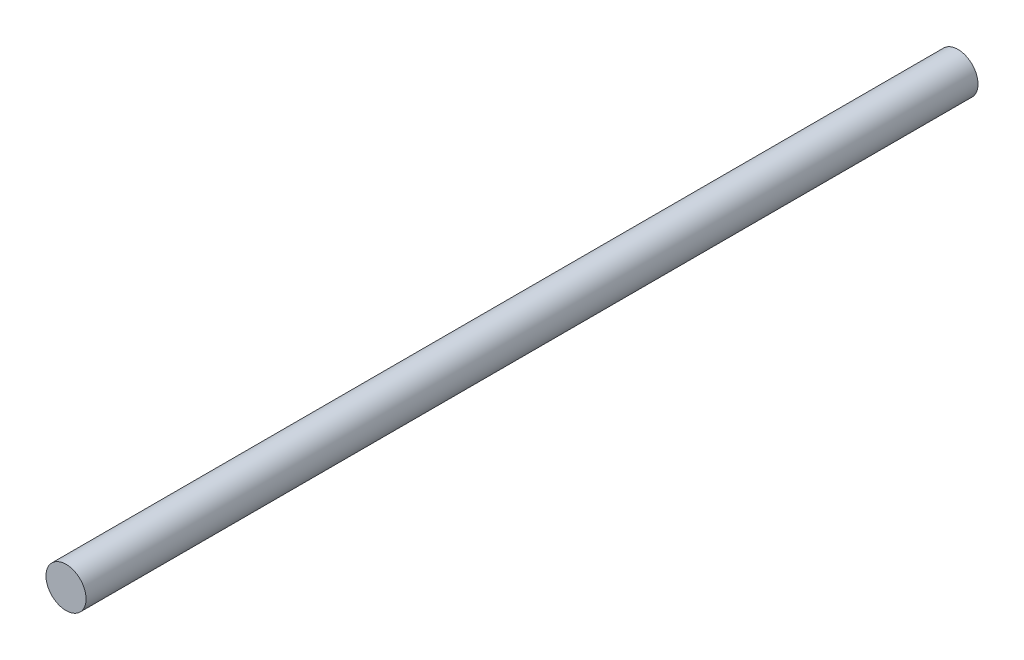
from build123d import *

# Parameters (mm, degrees)
SCHIZZO1_R                   = 9
ESTRUSIONE_ESTRUSIONE1_DEPTH = 400


with BuildPart() as part:
    # Schizzo1 → Estrusione-Estrusione1 (new body)
    with BuildSketch(Plane.XY):
        Circle(SCHIZZO1_R)
    extrude(amount=ESTRUSIONE_ESTRUSIONE1_DEPTH)


solid = part.part
